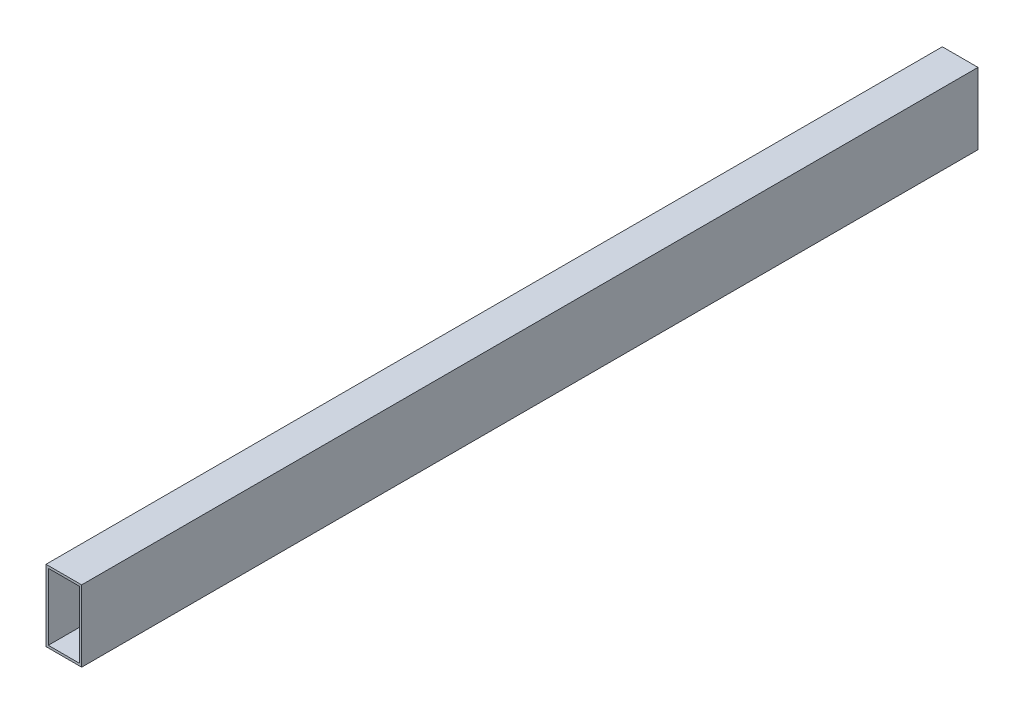
from build123d import *

# Parameters (mm, degrees)
SKETCH1_W           = 25.4
SKETCH1_H           = 50.8
BOSS_EXTRUDE1_DEPTH = 638.302
SKETCH2_W           = 22.098
SKETCH2_H           = 47.498
CUT_EXTRUDE1_DEPTH  = 641.849133052


with BuildPart() as part:
    # Sketch1 → Boss-Extrude1 (new body)
    with BuildSketch(Plane.XY):
        with Locations((-35.737209302, -4.799418605)):
            Rectangle(SKETCH1_W, SKETCH1_H)
    extrude(amount=BOSS_EXTRUDE1_DEPTH)

    # Sketch2 → Cut-Extrude1 (cut, through all)
    with BuildSketch(Plane.XY.offset(638.302)):
        with Locations((-35.737209302, -4.799418605)):
            Rectangle(SKETCH2_W, SKETCH2_H)
    extrude(amount=-CUT_EXTRUDE1_DEPTH, mode=Mode.SUBTRACT)


solid = part.part
